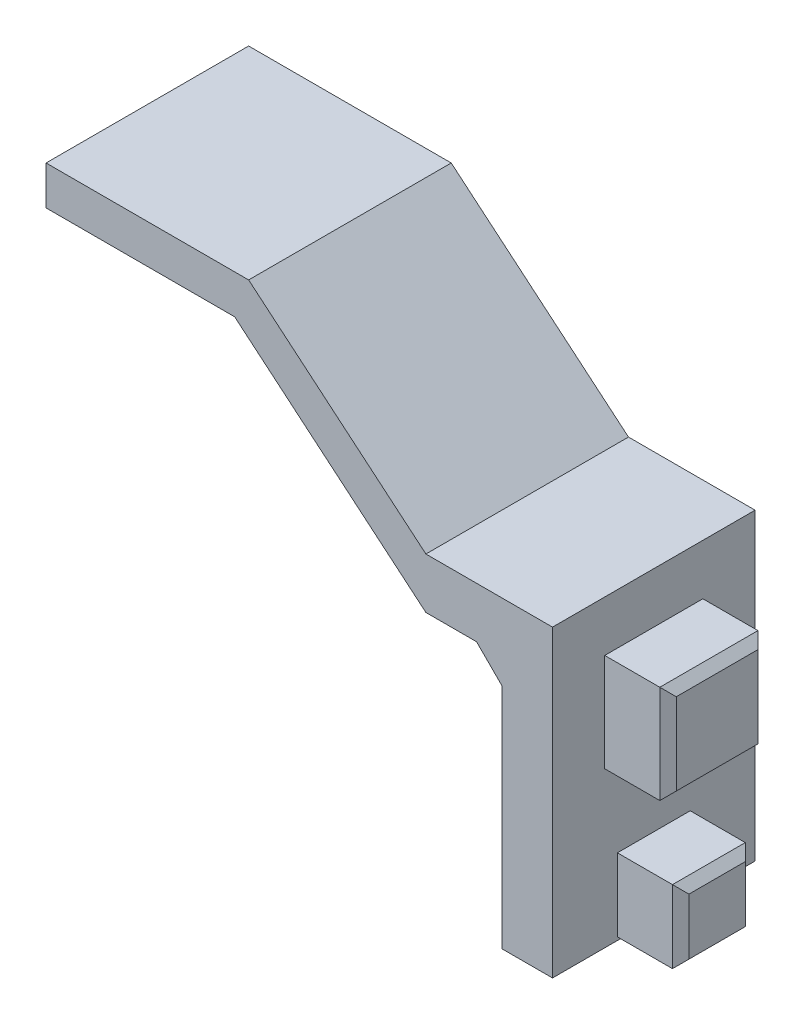
from build123d import *

# Parameters (mm, degrees)
BOSS_EXTRUDE1_DEPTH = 4
SKETCH1_3_W         = 2.5
SKETCH1_3_H         = 3.875
BOSS_EXTRUDE2_DEPTH = 1.9375
SKETCH1_4_W         = 2.5
SKETCH1_4_H         = 2.875
BOSS_EXTRUDE3_DEPTH = 1.4375
CHAMFER1_SIZE       = 0.325


with BuildPart() as part:
    # Sketch1 → Boss-Extrude1 (new, symmetric)
    with BuildSketch(Plane.XY):
        Polygon((-2, 0), (0, 0), (0, 12), (-5, 12), (-12, 17.873697418), (-20, 17.873697418), (-20, 16.335837533), (-12.550757142, 16.335837533), (-5, 10), (-3, 10), (-2, 9), align=None)
    extrude(amount=BOSS_EXTRUDE1_DEPTH, both=True)

    # Sketch1<3> → Boss-Extrude2 (add, symmetric)
    with BuildSketch(Plane.XY):
        with Locations((1.25, 8.0625)):
            Rectangle(SKETCH1_3_W, SKETCH1_3_H)
    extrude(amount=BOSS_EXTRUDE2_DEPTH, both=True)

    # Sketch1<4> → Boss-Extrude3 (add, symmetric)
    with BuildSketch(Plane.XY):
        with Locations((1.25, 1.5625)):
            Rectangle(SKETCH1_4_W, SKETCH1_4_H)
    extrude(amount=BOSS_EXTRUDE3_DEPTH, both=True)

    # Chamfer1
    chamfer1_edges = [part.edges().sort_by_distance(p)[0] for p in [
        (2.5, 0.125, 0),
        (2.5, 1.5625, 1.4375),
        (2.5, 3, 0),
        (2.5, 1.5625, -1.4375),
        (2.5, 6.125, 0),
        (2.5, 8.0625, 1.9375),
        (2.5, 10, 0),
        (2.5, 8.0625, -1.9375),
    ]]
    chamfer(chamfer1_edges, length=CHAMFER1_SIZE)


solid = part.part
